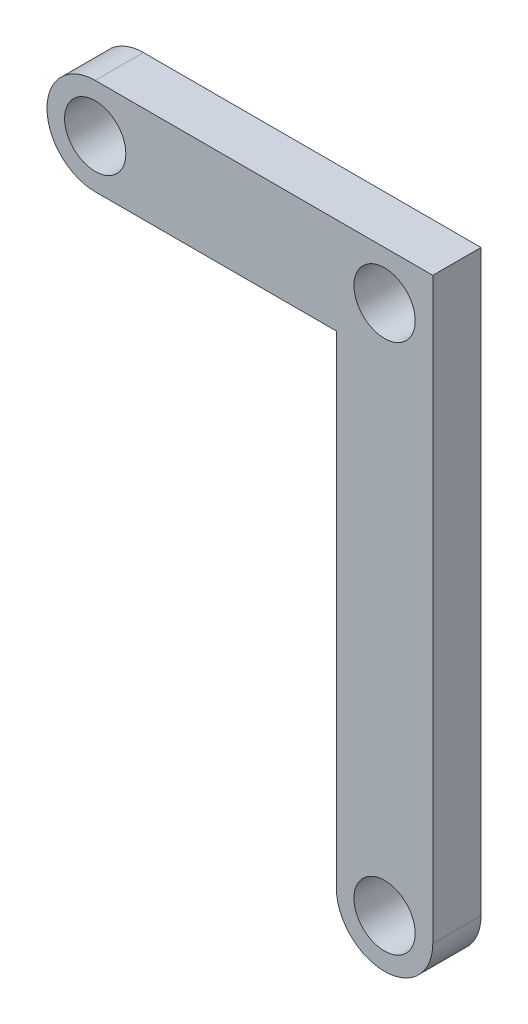
from build123d import *

# Parameters (mm, degrees)
CROQUIS1_R              = 3.175
SALIENTE_EXTRUIR1_DEPTH = 2.5


with BuildPart() as part:
    # Croquis1 → Saliente-Extruir1 (new, symmetric)
    with BuildSketch(Plane.XY):
        with BuildLine():
            Line((0, 0), (0, -50))
            ThreePointArc((0, -50), (5, -55), (10, -50))
            Line((10, -50), (10, 10))
            Line((10, 10), (-25, 10))
            ThreePointArc((-25, 10), (-30, 5), (-25, 0))
            Line((-25, 0), (0, 0))
        make_face()
        with Locations((5, -50)):
            Circle(CROQUIS1_R, mode=Mode.SUBTRACT)
        with Locations((5, 5)):
            Circle(CROQUIS1_R, mode=Mode.SUBTRACT)
        with Locations((-25, 5)):
            Circle(CROQUIS1_R, mode=Mode.SUBTRACT)
    extrude(amount=SALIENTE_EXTRUIR1_DEPTH, both=True)


solid = part.part
